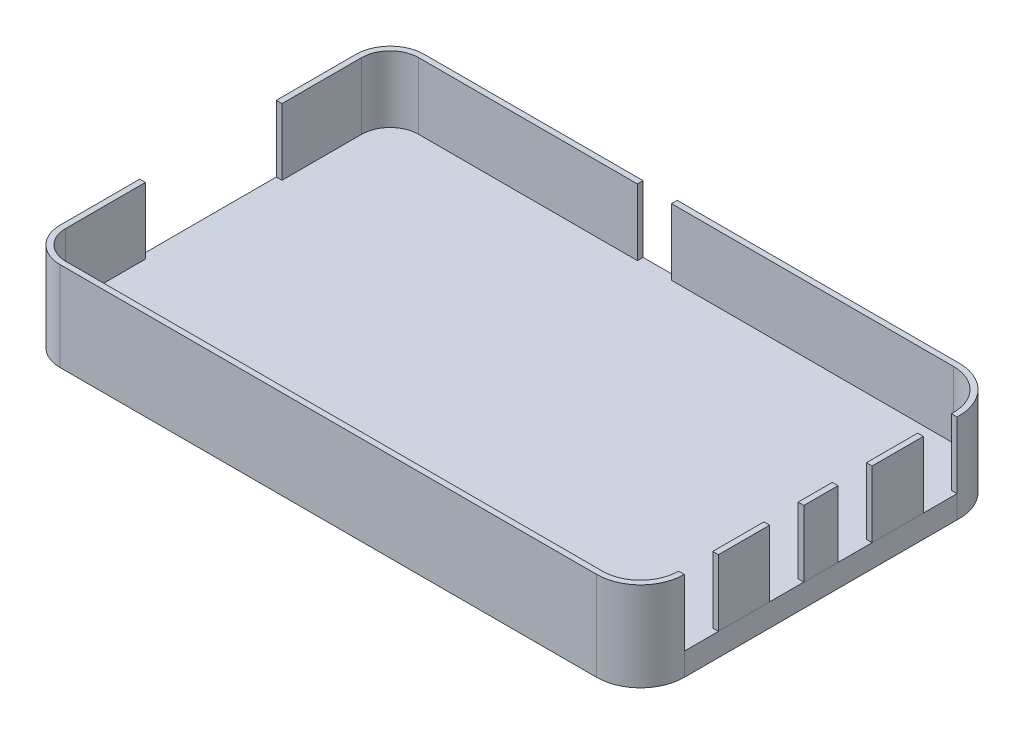
from build123d import *
from build123d.topology import SkipClean

# Parameters (mm, degrees)
Y_KSEKLIK_EKSTR_ZYON6_DEPTH   = 5.836879
Y_KSEKLIK_EKSTR_ZYON6_2_DEPTH = 5.836879
Y_KSEKLIK_EKSTR_ZYON6_3_DEPTH = 5.836879
IZIM5_W                       = 0.5
IZIM5_H                       = 4.5
Y_KSEKLIK_EKSTR_ZYON6_4_DEPTH = 5.836879
IZIM5_H_2                     = 3
Y_KSEKLIK_EKSTR_ZYON6_5_DEPTH = 5.836879
IZIM5_H_3                     = 4.500000477
Y_KSEKLIK_EKSTR_ZYON6_6_DEPTH = 5.836879
Y_KSEKLIK_EKSTR_ZYON7_START   = 2
Y_KSEKLIK_EKSTR_ZYON7_DEPTH   = 2
IZIM9_R                       = 1.5
IZIM9_R_2                     = 1.00000054
Y_KSEKLIK_EKSTR_ZYON10_DEPTH  = 1
IZIM15_R                      = 1.5
IZIM15_R_2                    = 1.00000054
KES_EKSTR_ZYON1_DEPTH         = 1
IZIM16_R                      = 1.00000054
KES_EKSTR_ZYON2_DEPTH         = 9


with BuildPart() as part:
    # Çizim5 → Yükseklik-Ekstrüzyon6 (new body)
    with BuildSketch(Plane(origin=(0, 0, 0), x_dir=(1, 0, 0), z_dir=(0, 1, 0))):
        with BuildLine():
            Line((49.998890085, 33.546469342), (25.224998474, 33.546469342))
            Line((25.224998474, 33.546469342), (25.224998474, 34.046469342))
            Line((25.224998474, 34.046469342), (49.998890085, 34.046469342))
            ThreePointArc((49.998890085, 34.046469342), (52.898283285, 32.804189289), (53.998828886, 29.848087119))
            Line((53.998828886, 29.848087119), (53.499414443, 29.872278319))
            ThreePointArc((53.499414443, 29.872278319), (52.536278036, 32.459294812), (49.998890085, 33.546469342))
        make_face()
    extrude(amount=Y_KSEKLIK_EKSTR_ZYON6_DEPTH)



with BuildPart() as body_2:
    # Çizim5 → Y_kseklik-Ekstr_zyon6 2 (new body)
    with BuildSketch(Plane(origin=(0, 0, 0), x_dir=(1, 0, 0), z_dir=(0, 1, 0))):
        with BuildLine():
            Line((50.149132956, 2.046469359), (3.000730401, 2.046469359))
            ThreePointArc((3.000730401, 2.046469359), (0.878893586, 2.925362945), (0, 5.04719976))
            Line((0, 5.04719976), (0, 12.046469359))
            Line((0, 12.046469359), (0.5, 12.046469359))
            Line((0.5, 12.046469359), (0.5, 5.04719976))
            ThreePointArc((0.5, 5.04719976), (1.232446977, 3.278916336), (3.000730401, 2.546469359))
            Line((3.000730401, 2.546469359), (50.149132956, 2.546469359))
            ThreePointArc((50.149132956, 2.546469359), (52.518193482, 3.52755531), (53.499999977, 5.896317313))
            Line((53.499999977, 5.896317313), (53.999999954, 5.896165229))
            ThreePointArc((53.999999954, 5.896165229), (52.871693099, 3.173948154), (50.149132956, 2.046469359))
        make_face()
    extrude(amount=Y_KSEKLIK_EKSTR_ZYON6_2_DEPTH)


with BuildPart() as body_3:
    # Çizim5 → Y_kseklik-Ekstr_zyon6 3 (new body)
    with BuildSketch(Plane(origin=(0, 0, 0), x_dir=(1, 0, 0), z_dir=(0, 1, 0))):
        with BuildLine():
            Line((0, 24.04646891), (0, 31.045738379))
            ThreePointArc((0, 31.045738379), (0.878893795, 33.167575698), (3.000731114, 34.046469493))
            Line((3.000731114, 34.046469493), (22.224998474, 34.046469493))
            Line((22.224998474, 34.046469493), (22.224998474, 33.546469493))
            Line((22.224998474, 33.546469493), (3.000731114, 33.546469493))
            ThreePointArc((3.000731114, 33.546469493), (1.232447185, 32.814022307), (0.5, 31.045738379))
            Line((0.5, 31.045738379), (0.5, 24.04646891))
            Line((0.5, 24.04646891), (0, 24.04646891))
        make_face()
    extrude(amount=Y_KSEKLIK_EKSTR_ZYON6_3_DEPTH)


with BuildPart() as body_4:
    # Çizim5 → Y_kseklik-Ekstr_zyon6 4 (new body)
    with BuildSketch(Plane(origin=(0, 0, 0), x_dir=(1, 0, 0), z_dir=(0, 1, 0))):
        with Locations((53.75, 24.646469741)):
            Rectangle(IZIM5_W, IZIM5_H)
    extrude(amount=Y_KSEKLIK_EKSTR_ZYON6_4_DEPTH)


with BuildPart() as body_5:
    # Çizim5 → Y_kseklik-Ekstr_zyon6 5 (new body)
    with BuildSketch(Plane(origin=(0, 0, 0), x_dir=(1, 0, 0), z_dir=(0, 1, 0))):
        with Locations((53.75, 17.896469741)):
            Rectangle(IZIM5_W, IZIM5_H_2)
    extrude(amount=Y_KSEKLIK_EKSTR_ZYON6_5_DEPTH)


with BuildPart() as body_6:
    # Çizim5 → Y_kseklik-Ekstr_zyon6 6 (new body)
    with BuildSketch(Plane(origin=(0, 0, 0), x_dir=(1, 0, 0), z_dir=(0, 1, 0))):
        with Locations((53.75, 11.146469503)):
            Rectangle(IZIM5_W, IZIM5_H_3)
    extrude(amount=Y_KSEKLIK_EKSTR_ZYON6_6_DEPTH)


with BuildPart() as part_1:
    add(part.part)

    add(body_2.part)  # Yükseklik-Ekstrüzyon7 merges body 2

    add(body_3.part)  # Yükseklik-Ekstrüzyon7 merges body 3

    add(body_4.part)  # Yükseklik-Ekstrüzyon7 merges body 4

    add(body_5.part)  # Yükseklik-Ekstrüzyon7 merges body 5

    add(body_6.part)  # Yükseklik-Ekstrüzyon7 merges body 6
    # Çizim6 → Yükseklik-Ekstrüzyon7 (add)
    with BuildSketch(Plane.XZ.offset(Y_KSEKLIK_EKSTR_ZYON7_START)):
        with BuildLine():
            Line((0, -31.045738379), (0, -5.04719976))
            ThreePointArc((0, -5.04719976), (0.878893586, -2.925362945), (3.000730401, -2.046469359))
            Line((3.000730401, -2.046469359), (50.149132956, -2.046469359))
            ThreePointArc((50.149132956, -2.046469359), (52.871693099, -3.173948154), (53.999999954, -5.896165229))
            Line((53.999999954, -5.896165229), (53.998828886, -29.848087119))
            ThreePointArc((53.998828886, -29.848087119), (52.898283285, -32.804189289), (49.998890085, -34.046469342))
            Line((49.998890085, -34.046469342), (3.000731114, -34.046469493))
            ThreePointArc((3.000731114, -34.046469493), (0.878893795, -33.167575698), (0, -31.045738379))
        make_face()
    extrude(amount=-Y_KSEKLIK_EKSTR_ZYON7_DEPTH)

    # Çizim9 → Yükseklik-Ekstrüzyon10 (add)
    # profile 1 of 2: a face of its own
    with BuildSketch(Plane(origin=(0, 0, 0), x_dir=(1, 0, 0), z_dir=(0, 1, 0))):
        with Locations(Location((3.00000102, 5.046470439, 0), (0, 0, 90))):
            Circle(IZIM9_R)
        with Locations(Location((3.00000102, 5.046470439, 0), (0, 0, 270))):
            Circle(IZIM9_R_2, mode=Mode.SUBTRACT)
    # profile 2 of 2: a face of its own
    with BuildSketch(Plane(origin=(0, 0, 0), x_dir=(1, 0, 0), z_dir=(0, 1, 0))):
        with Locations(Location((50.5, 27.946470359, 0), (0, 0, 90))):
            Circle(IZIM9_R)
        with Locations(Location((50.5, 27.946470359, 0), (0, 0, 270))):
            Circle(IZIM9_R_2, mode=Mode.SUBTRACT)
    extrude(amount=Y_KSEKLIK_EKSTR_ZYON10_DEPTH)

    # Çizim15 → Kes-Ekstrüzyon1 (cut)
    # profile 1 of 2: a face of its own
    with BuildSketch(Plane.XZ.offset(2)):
        with Locations(Location((3.00000102, -5.046470439, 0), (0, 0, 270))):
            Circle(IZIM15_R)
        with Locations(Location((3.00000102, -5.046470439, 0), (0, 0, 90))):
            Circle(IZIM15_R_2, mode=Mode.SUBTRACT)
    # profile 2 of 2: a face of its own
    with BuildSketch(Plane.XZ.offset(2)):
        with Locations(Location((50.5, -27.946470359, 0), (0, 0, 270))):
            Circle(IZIM15_R)
        with Locations(Location((50.5, -27.946470359, 0), (0, 0, 90))):
            Circle(IZIM15_R_2, mode=Mode.SUBTRACT)
    extrude(amount=-KES_EKSTR_ZYON1_DEPTH, mode=Mode.SUBTRACT)

    # Çizim16 → Kes-Ekstrüzyon2 (cut)
    with SkipClean():  # the faces are left unmerged after this step: merging them gives an invalid solid
        with BuildSketch(Plane.XZ.offset(2)):
            with Locations(Location((3.00000102, -5.046470439, 0), (0, 0, 270))):
                Circle(IZIM16_R)
            with Locations(Location((50.5, -27.946470359, 0), (0, 0, 270))):
                Circle(IZIM16_R)
        extrude(amount=-KES_EKSTR_ZYON2_DEPTH, mode=Mode.SUBTRACT)


solid = part_1.part
